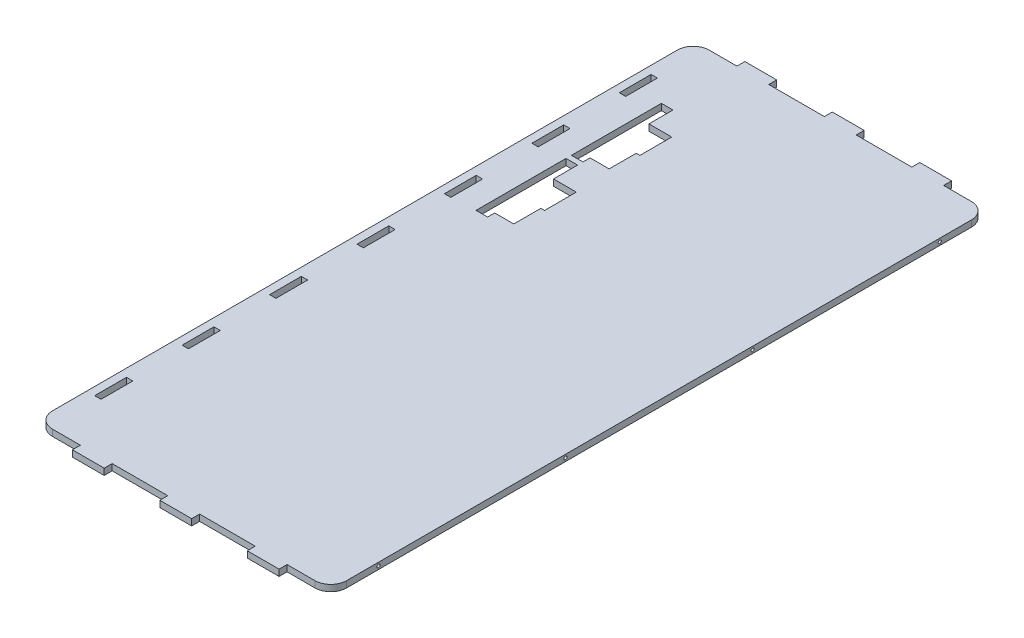
from build123d import *

# Parameters (mm, degrees)
SKETCH1_W               = 185
SKETCH1_H               = 413
BASE_DEPTH              = 4
SKETCH2_W               = 20
SKETCH2_H               = 5
BOSS_EXTRUDE2_DEPTH     = 4
LPATTERN1_COUNT         = 2
LPATTERN1_PITCH         = 55
LPATTERN1_COL_COUNT     = 2
LPATTERN1_COL_PITCH     = 55
SKETCH3_W               = 4
SKETCH3_H               = 20
CUT_EXTRUDE1_DEPTH      = 231.877673238
LPATTERN2_COUNT         = 4
LPATTERN2_PITCH         = 55
LPATTERN2_COL_COUNT     = 4
LPATTERN2_COL_PITCH     = 55
FILLET1_R               = 10
MIRROR1_COPY_1_SKETCH_W = 20
MIRROR1_COPY_1_SKETCH_H = 5
MIRROR1_COPY_1_DEPTH    = 4
MIRROR1_COPY_2_SKETCH_W = 20
MIRROR1_COPY_2_SKETCH_H = 5
MIRROR1_COPY_2_DEPTH    = 4
CUT_EXTRUDE4_DEPTH      = 231.877673238
LPATTERN5_COUNT         = 4
LPATTERN5_PITCH         = 117.666666667


with BuildPart() as part:
    # Sketch1 → Base (new body)
    with BuildSketch(Plane(origin=(0, 0, 0), x_dir=(1, 0, 0), z_dir=(0, 1, 0))):
        Rectangle(SKETCH1_W, SKETCH1_H)
    extrude(amount=BASE_DEPTH)

    # Sketch2 → Boss-Extrude2 (add)
    with BuildSketch(Plane(origin=(0, 4, 0), x_dir=(1, 0, 0), z_dir=(0, 1, 0))):
        with Locations((0, -209)):
            Rectangle(SKETCH2_W, SKETCH2_H)
    boss_extrude2 = extrude(amount=-BOSS_EXTRUDE2_DEPTH)

    # LPattern1: Boss-Extrude2 ×2
    with Locations(*[(-i * LPATTERN1_PITCH, 0, 0) for i in range(1, LPATTERN1_COUNT)]):
        add(boss_extrude2)

    # LPattern1 col: Boss-Extrude2 ×2
    with Locations(*[(i * LPATTERN1_COL_PITCH, 0, 0) for i in range(1, LPATTERN1_COL_COUNT)]):
        add(boss_extrude2)

    # Sketch3 → Cut-Extrude1 (cut, through all)
    with BuildSketch(Plane(origin=(0, 4, 0), x_dir=(1, 0, 0), z_dir=(0, 1, 0))):
        with Locations((-85.5, 0)):
            Rectangle(SKETCH3_W, SKETCH3_H)
    cut_extrude1 = extrude(amount=-CUT_EXTRUDE1_DEPTH, mode=Mode.SUBTRACT)

    # LPattern2: Cut-Extrude1 ×4
    with Locations(*[(0, 0, -i * LPATTERN2_PITCH) for i in range(1, LPATTERN2_COUNT)]):
        add(cut_extrude1, mode=Mode.SUBTRACT)

    # LPattern2 col: Cut-Extrude1 ×4
    with Locations(*[(0, 0, i * LPATTERN2_COL_PITCH) for i in range(1, LPATTERN2_COL_COUNT)]):
        add(cut_extrude1, mode=Mode.SUBTRACT)

    # Fillet1
    fillet1_edges = [part.edges().sort_by_distance(p)[0] for p in [
        (-92.5, 2, -206.5),
        (92.5, 2, -206.5),
        (92.5, 2, 206.5),
        (-92.5, 2, 206.5),
    ]]
    fillet(fillet1_edges, radius=FILLET1_R)

    # Mirror1: Boss-Extrude2 across plane
    add(boss_extrude2.mirror(Plane.XY))

    # Mirror1 copy 1 sketch → Mirror1 copy 1 (add)
    with BuildSketch(Plane(origin=(-55, 4, 0), x_dir=(1, 0, 0), z_dir=(0, 1, 0))):
        with Locations((0, 209)):
            Rectangle(MIRROR1_COPY_1_SKETCH_W, MIRROR1_COPY_1_SKETCH_H)
    extrude(amount=-MIRROR1_COPY_1_DEPTH)

    # Mirror1 copy 2 sketch → Mirror1 copy 2 (add)
    with BuildSketch(Plane(origin=(55, 4, 0), x_dir=(1, 0, 0), z_dir=(0, 1, 0))):
        with Locations((0, 209)):
            Rectangle(MIRROR1_COPY_2_SKETCH_W, MIRROR1_COPY_2_SKETCH_H)
    extrude(amount=-MIRROR1_COPY_2_DEPTH)

    # Sketch5 → Cut-Extrude4 (cut, through all)
    with BuildSketch(Plane(origin=(0, 4, 0), x_dir=(1, 0, 0), z_dir=(0, 1, 0))):
        Polygon((-46.895000001, 87.351848615), (-61.230000001, 87.351848615), (-61.230000001, 102.480848615), (-68.500000001, 102.480848615), (-68.500000001, 45.870848615), (-61.230000001, 45.870848615), (-61.230000001, 50.331848615), (-49.211989258, 50.331848615), (-49.211989258, 67.349848615), (-46.895000001, 67.349848615), align=None)
        Polygon((-46.895000001, 147.351848615), (-61.230000001, 147.351848615), (-61.230000001, 162.480848615), (-68.500000001, 162.480848615), (-68.500000001, 105.870848615), (-61.230000001, 105.870848615), (-61.230000001, 110.331848615), (-49.211989258, 110.331848615), (-49.211989258, 127.349848615), (-46.895000001, 127.349848615), align=None)
    extrude(amount=-CUT_EXTRUDE4_DEPTH, mode=Mode.SUBTRACT)

    # Sketch8 → Tap Drill for M2.5x0.45 Tap1 (revolve, cut)
    with BuildSketch(Plane(origin=(92.5, 2, -176.5), x_dir=(0, 0, -1), z_dir=(0, 1, 0))):
        Polygon((0, 0), (0, 5.615882135), (1.025, 5), (1.025, 0), align=None)
    tap_drill_for_m2_5x0_45_tap1 = revolve(axis=Axis((98.85, 2, -176.5), (-1, 0, 0)), mode=Mode.SUBTRACT)

    # LPattern5: Tap Drill for M2.5x0.45 Tap1 ×4
    with Locations(*[(0, 0, i * LPATTERN5_PITCH) for i in range(1, LPATTERN5_COUNT)]):
        add(tap_drill_for_m2_5x0_45_tap1, mode=Mode.SUBTRACT)


solid = part.part
